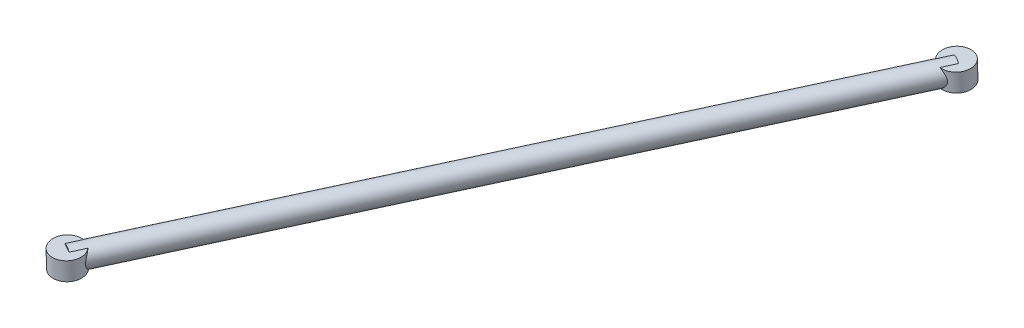
from build123d import *

# Parameters (mm, degrees)
SUSP_FL_PUSHROD_PROFILE_R                = 8
SUSP_FL_PUSHROD_ROD_END_MOUNT_PROFILE_R  = 11
SUSP_FL_PUSHROD_ROD_END_ROCKER_PROFILE_R = 11


with BuildPart() as part:
    # SUSP_FL_pushrod: sweep along a curve in space
    with BuildLine() as susp_fl_pushrod_path:
        Line((-535.6, -114.51, -83.23), (-308.5607, -96.2566, -516.2583))
    # SUSP_FL_pushrod profile (on start of the path) → SUSP_FL_pushrod (sweep)
    with BuildSketch(Plane(origin=(-535.6, -114.51, -83.23), x_dir=(-0.8856507656122407, 0, -0.46435193697286564), z_dir=(0.46402868322134944, 0.037306762161055766, -0.8850342290809543))):
        Circle(SUSP_FL_PUSHROD_PROFILE_R)
    sweep(path=susp_fl_pushrod_path.line)

    # SUSP_FL_pushrod_rod_end_mount: sweep along a curve in space
    with BuildLine() as susp_fl_pushrod_rod_end_mount_path:
        Line((-535.735806, -121.4991, -83.5961157), (-535.464194, -107.5209, -82.8638843))
    # SUSP_FL_pushrod_rod_end_mount profile (on start of the path) → SUSP_FL_pushrod_rod_end_mount (sweep)
    with BuildSketch(Plane(origin=(-535.735806, -121.4991, -83.5961157), x_dir=(0, -0.052312087255056115, 0.9986307853891845), z_dir=(0.019400856591433174, 0.9984428287644381, 0.052302241370573335))):
        Circle(SUSP_FL_PUSHROD_ROD_END_MOUNT_PROFILE_R)
    sweep(path=susp_fl_pushrod_rod_end_mount_path.line)

    # SUSP_FL_pushrod_rod_end_rocker: sweep along a curve in space
    with BuildLine() as susp_fl_pushrod_rod_end_rocker_path:
        Line((-308.696506, -103.2457, -516.624416), (-308.424894, -89.2675002, -515.892184))
    # SUSP_FL_pushrod_rod_end_rocker profile (on start of the path) → SUSP_FL_pushrod_rod_end_rocker (sweep)
    with BuildSketch(Plane(origin=(-308.696506, -103.2457, -516.624416), x_dir=(0, -0.052312130749392324, 0.9986307831107845), z_dir=(0.019400856824669174, 0.9984428264819472, 0.05230228485648652))):
        Circle(SUSP_FL_PUSHROD_ROD_END_ROCKER_PROFILE_R)
    sweep(path=susp_fl_pushrod_rod_end_rocker_path.line)


solid = part.part
